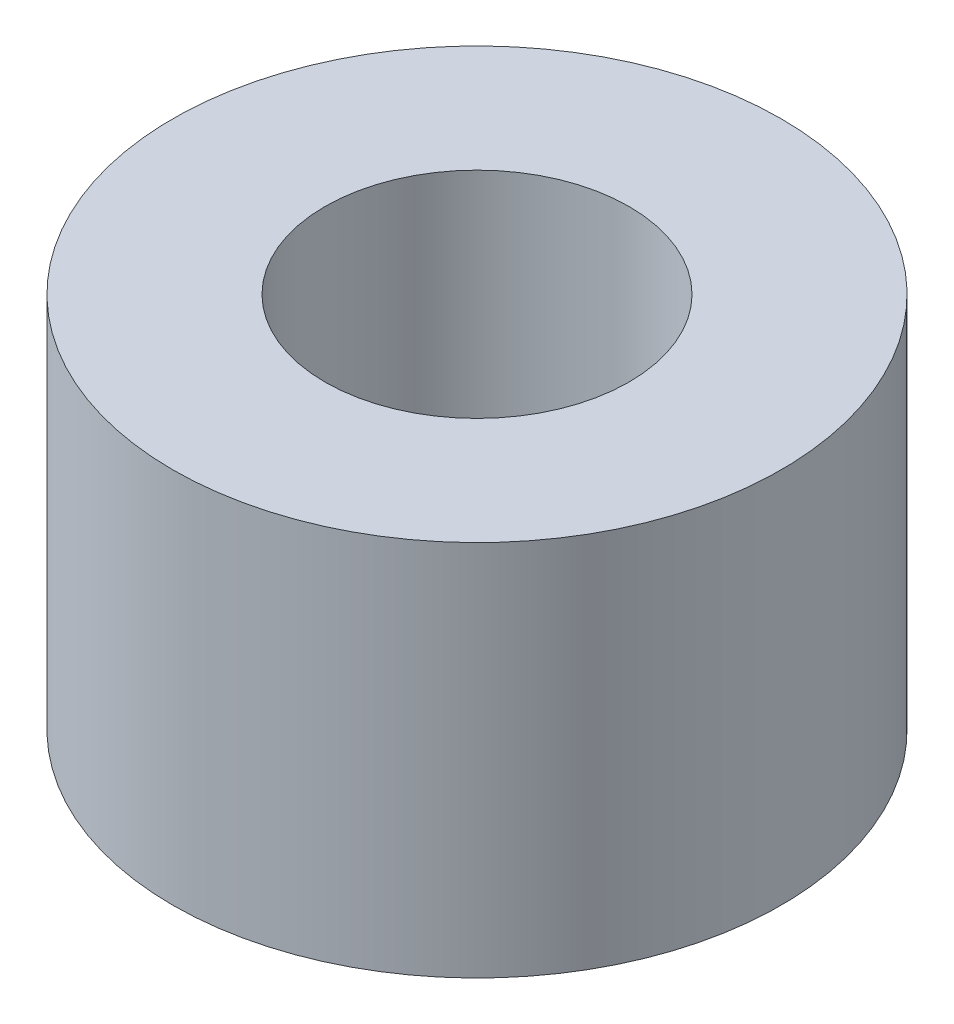
from build123d import *

# Parameters (mm, degrees)
SKETCH1_R           = 6.35
SKETCH1_R_2         = 3.175
BOSS_EXTRUDE1_DEPTH = 7.874


with BuildPart() as part:
    # Sketch1 → Boss-Extrude1 (new body)
    with BuildSketch(Plane(origin=(0, 0, 0), x_dir=(1, 0, 0), z_dir=(0, 1, 0))):
        with Locations(Location((0, 0, 0), (0, 0, 270))):
            Circle(SKETCH1_R)
        with Locations(Location((0, 0, 0), (0, 0, 270))):
            Circle(SKETCH1_R_2, mode=Mode.SUBTRACT)
    extrude(amount=BOSS_EXTRUDE1_DEPTH)


solid = part.part
